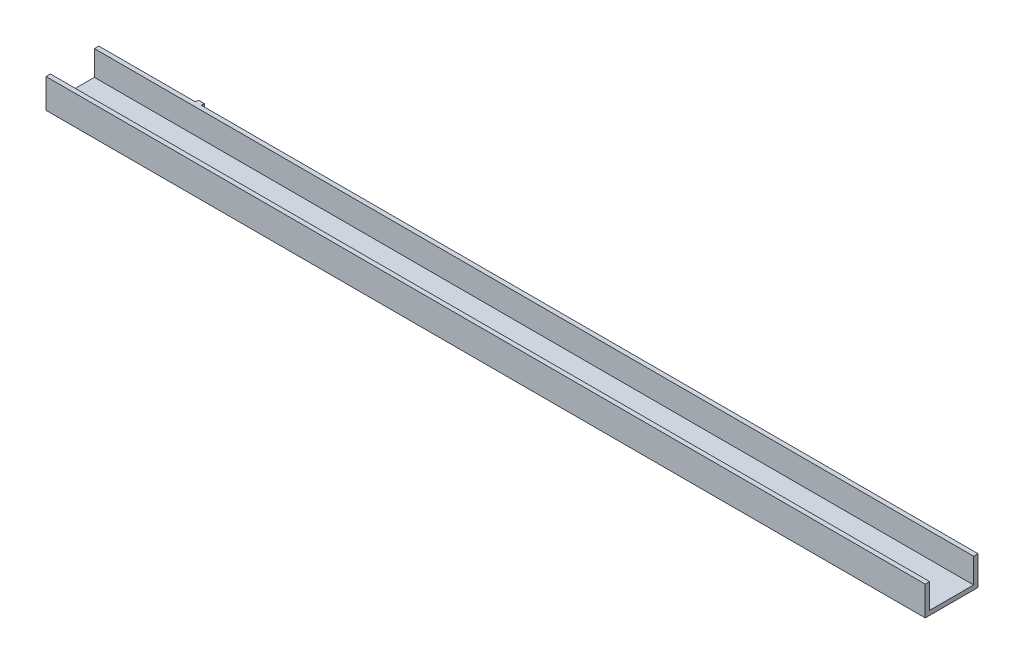
from build123d import *

# Parameters (mm, degrees)
BOSS_EXTRUDE1_DEPTH = 300
SKETCH2_W           = 2
SKETCH2_H           = 10
BOSS_EXTRUDE2_DEPTH = 1


with BuildPart() as part:
    # Sketch1 → Boss-Extrude1 (new body)
    with BuildSketch(Plane(origin=(0, 0, 0), x_dir=(0, 0, -1), z_dir=(1, 0, 0))):
        Polygon((-9, -6.423948176), (9, -6.423948176), (9, 3.576051824), (7.5, 3.576051824), (7.5, -4.923948176), (-7.5, -4.923948176), (-7.5, 3.576051824), (-9, 3.576051824), align=None)
    extrude(amount=BOSS_EXTRUDE1_DEPTH)

    # Sketch2 → Boss-Extrude2 (add)
    with BuildSketch(Plane(origin=(0, 0, -9), x_dir=(-1, 0, 0), z_dir=(0, 0, -1))):
        with Locations((-34, -1.423948176)):
            Rectangle(SKETCH2_W, SKETCH2_H)
    extrude(amount=BOSS_EXTRUDE2_DEPTH)


solid = part.part
